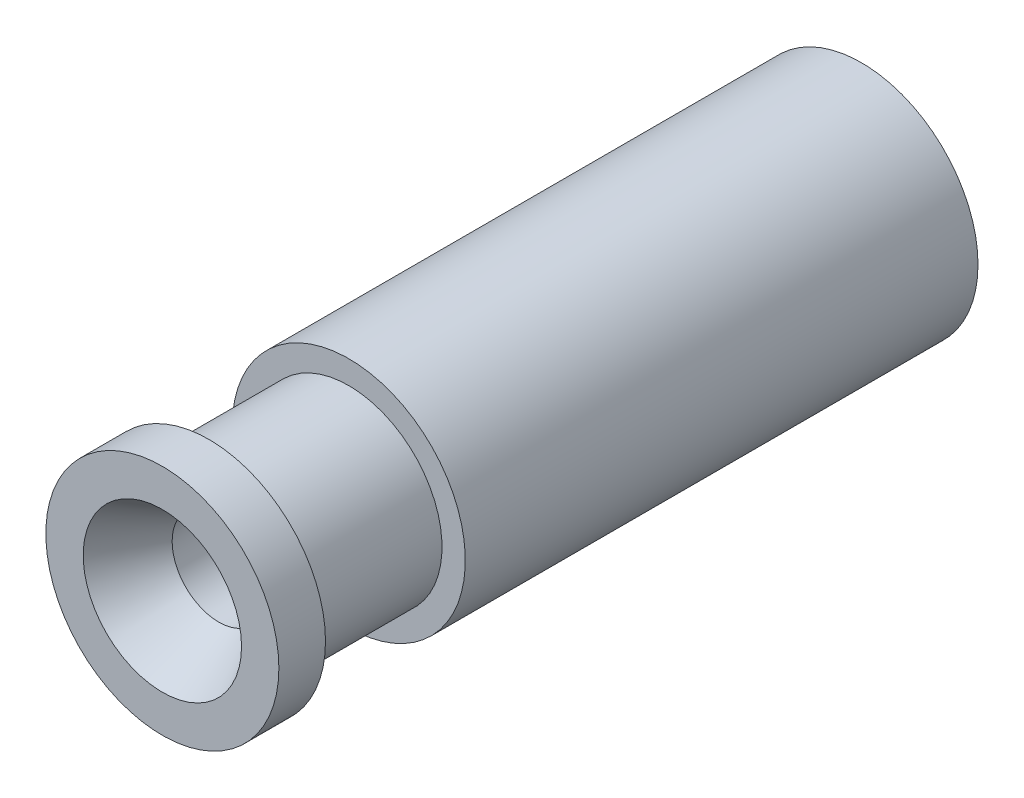
from build123d import *

# Parameters (mm, degrees)
SKETCH1_R                       = 2.5
BOSS_EXTRUDE1_DEPTH             = 15
SKETCH2_R                       = 1
CUT_EXTRUDE1_DEPTH              = 16.411035007
TAP_DRILL_FOR_M4X0_7_TAP1_D     = 3.3
TAP_DRILL_FOR_M4X0_7_TAP1_DEPTH = 9
TAP_DRILL_FOR_M4X0_7_TAP1_TIP   = 0.991420021
SKETCH5_W                       = 3
SKETCH5_H                       = 1.793791595
CHAMFER1_SIZE                   = 0.5
CHAMFER1_SIZE2                  = 0.866025404
CHAMFER2_SIZE                   = 1.21
CHAMFER2_SIZE2                  = 0.698593826


with BuildPart() as part:
    # Sketch1 → Boss-Extrude1 (new body)
    with BuildSketch(Plane.XY):
        Circle(SKETCH1_R)
    extrude(amount=BOSS_EXTRUDE1_DEPTH)

    # Sketch2 → Cut-Extrude1 (cut, through all)
    with BuildSketch(Plane(origin=(0, 0, 0), x_dir=(-1, 0, 0), z_dir=(0, 0, -1))):
        Circle(SKETCH2_R)
    extrude(amount=-CUT_EXTRUDE1_DEPTH, mode=Mode.SUBTRACT)

    # Tap Drill for M4x0.7 Tap1
    with Locations(Plane(origin=(0, 0, 0), x_dir=(-1, 0, 0), z_dir=(0, 0, -1))):
        with Locations((0, 0)):
            Hole(TAP_DRILL_FOR_M4X0_7_TAP1_D / 2, depth=TAP_DRILL_FOR_M4X0_7_TAP1_DEPTH)
            with Locations((0, 0, -(TAP_DRILL_FOR_M4X0_7_TAP1_DEPTH + TAP_DRILL_FOR_M4X0_7_TAP1_TIP / 2))):  # 118° drill point
                Cone(0, TAP_DRILL_FOR_M4X0_7_TAP1_D / 2, TAP_DRILL_FOR_M4X0_7_TAP1_TIP, mode=Mode.SUBTRACT)

    # Sketch5 → Cut-Revolve1 (revolve, cut)
    with BuildSketch(Plane(origin=(0, 0, 0), x_dir=(0, 0, -1), z_dir=(1, 0, 0)), mode=Mode.PRIVATE) as cut_revolve1_sk:
        with Locations((-12.5, 2.896895798)):
            Rectangle(SKETCH5_W, SKETCH5_H)
    revolve(cut_revolve1_sk.sketch.rotate(Axis((0, 0, 0), (0, 0, 1)), 90), axis=Axis((0, 0, 0), (0, 0, 1)), mode=Mode.SUBTRACT)

    # Chamfer1
    chamfer1_edges = [part.edges().sort_by_distance(p)[0] for p in [
        (-1.65, 0, 0),
    ]]
    chamfer1_side = [part.faces().sort_by_distance(p)[0] for p in [
        (-2.429289322, 0, 0),
    ]]
    chamfer(chamfer1_edges, length=CHAMFER1_SIZE, length2=CHAMFER1_SIZE2, reference=chamfer1_side[0])

    # Chamfer2
    chamfer2_edges = [part.edges().sort_by_distance(p)[0] for p in [
        (1, 0, 15),
    ]]
    chamfer2_side = [part.faces().sort_by_distance(p)[0] for p in [
        (1, 0, 12.195279701),
    ]]
    chamfer(chamfer2_edges, length=CHAMFER2_SIZE, length2=CHAMFER2_SIZE2, reference=chamfer2_side[0])


solid = part.part
